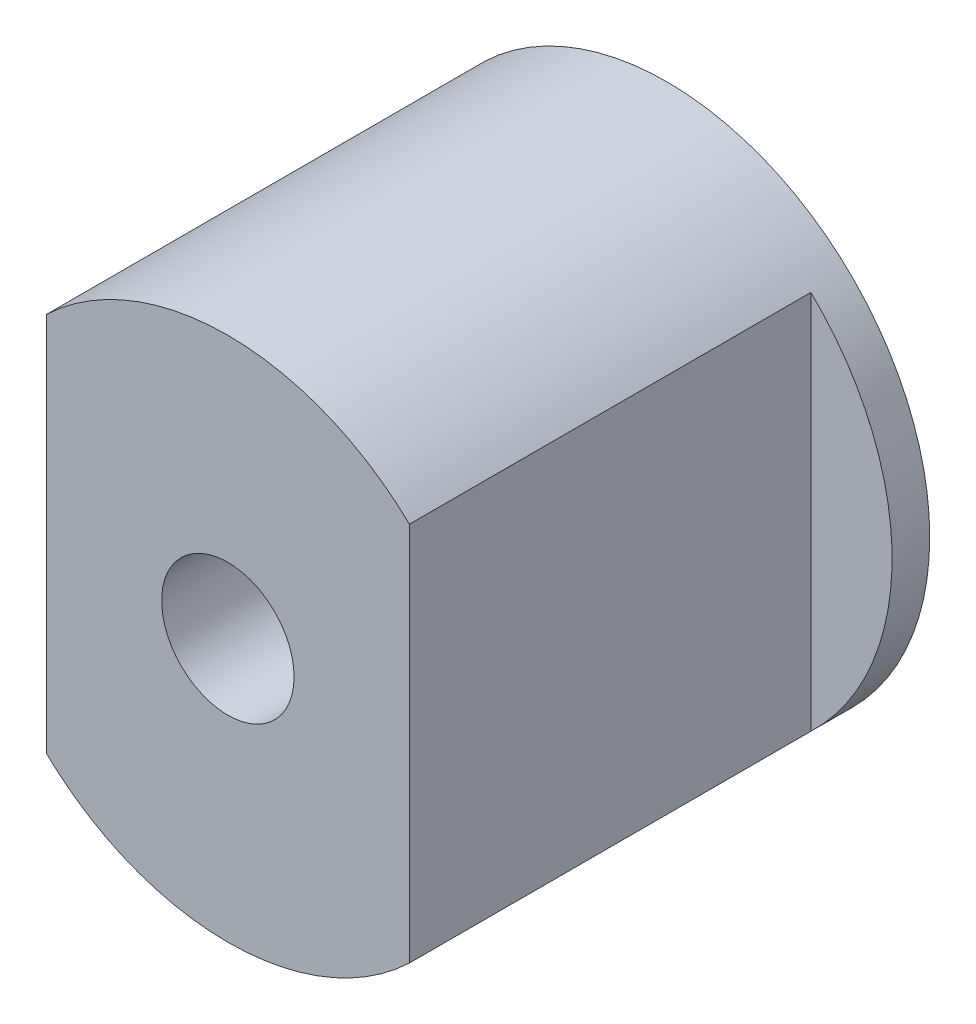
from build123d import *
from build123d.topology import SkipClean

# Parameters (mm, degrees)
SKETCH1_R          = 3.4925
EXTRUDE1_DEPTH     = 0.5
EXTRUDE2_DEPTH     = 5.334
CUT_EXTRUDE1_REACH = 9.644
SKETCH3_R          = 0.88


with BuildPart() as part:
    # Sketch1 → Extrude1 (new body)
    with BuildSketch(Plane.XY):
        with Locations(Location((0, 0, 0), (0, 0, 133.702114437))):
            Circle(SKETCH1_R)
    extrude(amount=EXTRUDE1_DEPTH)

    # Sketch2 → Extrude2 (add)
    with SkipClean():  # the faces are left unmerged after this step: merging them gives an invalid solid
        with BuildSketch(Plane.XY.offset(0.5)):
            with BuildLine():
                Line((2.413, -2.52487371), (2.413, 2.52487371))
                ThreePointArc((2.413, 2.52487371), (0, 3.4925), (-2.413, 2.52487371))
                Line((-2.413, 2.52487371), (-2.413, -2.52487371))
                ThreePointArc((-2.413, -2.52487371), (0, -3.4925), (2.413, -2.52487371))
            make_face()
        extrude(amount=EXTRUDE2_DEPTH)

    # Sketch3 → Cut-Extrude1 (cut, up to next)
    with BuildSketch(Plane.XY.offset(5.834), mode=Mode.PRIVATE) as cut_extrude1_sk1:
        Circle(SKETCH3_R)
    cut_extrude1_tool1 = extrude(cut_extrude1_sk1.sketch, amount=-CUT_EXTRUDE1_REACH, mode=Mode.PRIVATE) & part.part
    add(cut_extrude1_tool1.solids().sort_by_distance((0, 0, 5.834))[0], mode=Mode.SUBTRACT)


solid = part.part
